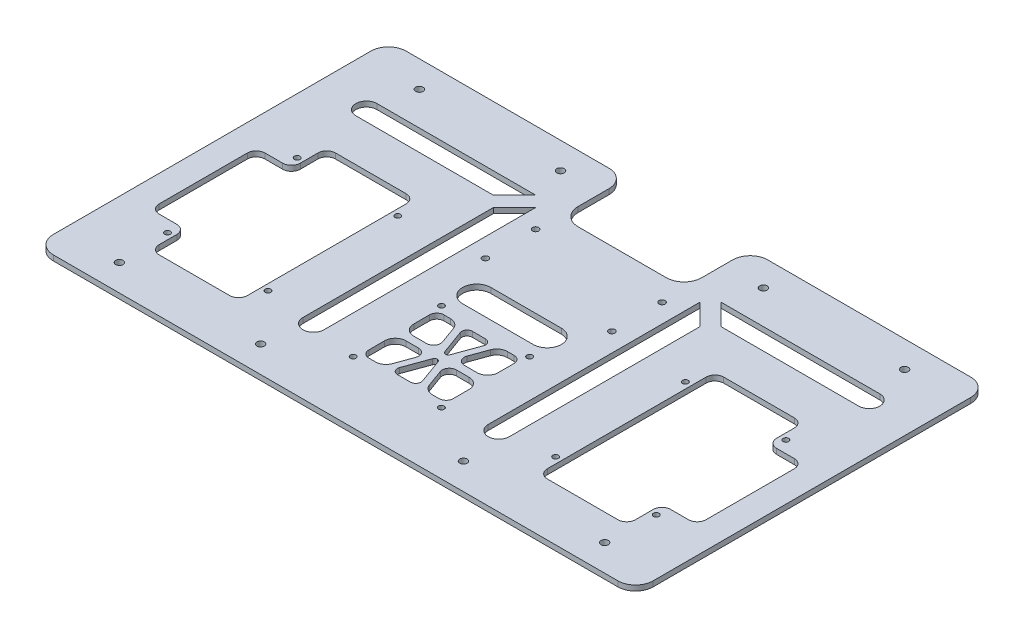
from build123d import *

# Parameters (mm, degrees)
SKETCH_1_W           = 435
SKETCH_1_H           = 200
EXTRUDE_1_DEPTH      = 3
SKETCH_2_R           = 1.6
CUT_EXTRUDE_1_DEPTH  = 157
SKETCH_3_W           = 50
SKETCH_3_H           = 100
CUT_EXTRUDE_2_DEPTH  = 157
SKETCH_5_W           = 20
SKETCH_5_H           = 60
CUT_EXTRUDE_3_DEPTH  = 157
FILLET_1_R           = 5
SKETCH_9_R           = 2.1
CUT_EXTRUDE_6_DEPTH  = 10
SKETCH_10_R          = 1.6
CUT_EXTRUDE_7_DEPTH  = 10
SKETCH_8_R           = 1.75
CUT_EXTRUDE_8_DEPTH  = 10
SKETCH_13_W          = 53.114182181
SKETCH_13_H          = 240.503799042
CUT_EXTRUDE_11_DEPTH = 10
SKETCH_14_W          = 70
SKETCH_14_H          = 75
CUT_EXTRUDE_12_DEPTH = 64.5
FILLET_4_R           = 10
CUT_EXTRUDE_13_DEPTH = 10
EXTRUDE_3_DEPTH      = 3


with BuildPart() as part:
    # 草图1 → 凸台-拉伸1 (new body)
    with BuildSketch(Plane(origin=(0, 0, 0), x_dir=(1, 0, 0), z_dir=(0, 1, 0))):
        Rectangle(SKETCH_1_W, SKETCH_1_H)
    extrude(amount=EXTRUDE_1_DEPTH)

    # 草图2 → 切除-拉伸1 (cut)
    with BuildSketch(Plane(origin=(0, 3, 0), x_dir=(1, 0, 0), z_dir=(0, 1, 0))):
        with Locations(Location((138.5, 16.75, 0), (0, 0, 270))):
            Circle(SKETCH_2_R)
        with Locations(Location((138.5, -56.75, 0), (0, 0, 270))):
            Circle(SKETCH_2_R)
        with Locations(Location((81.5, -56.75, 0), (0, 0, 270))):
            Circle(SKETCH_2_R)
        with Locations(Location((81.5, 16.75, 0), (0, 0, 270))):
            Circle(SKETCH_2_R)
        with Locations(Location((-81.5, 16.75, 0), (0, 0, 270))):
            Circle(SKETCH_2_R)
        with Locations(Location((-81.5, -56.75, 0), (0, 0, 270))):
            Circle(SKETCH_2_R)
        with Locations(Location((-138.5, -56.75, 0), (0, 0, 270))):
            Circle(SKETCH_2_R)
        with Locations(Location((-138.5, 16.75, 0), (0, 0, 270))):
            Circle(SKETCH_2_R)
    extrude(amount=-CUT_EXTRUDE_1_DEPTH, mode=Mode.SUBTRACT)

    # 草图3 → 切除-拉伸2 (cut)
    with BuildSketch(Plane(origin=(0, 3, 0), x_dir=(1, 0, 0), z_dir=(0, 1, 0))):
        with Locations((-110, -20)):
            Rectangle(SKETCH_3_W, SKETCH_3_H)
        with Locations((110, -20)):
            Rectangle(SKETCH_3_W, SKETCH_3_H)
    extrude(amount=-CUT_EXTRUDE_2_DEPTH, mode=Mode.SUBTRACT)

    # 草图5 → 切除-拉伸3 (cut)
    with BuildSketch(Plane(origin=(0, 3, 0), x_dir=(1, 0, 0), z_dir=(0, 1, 0))):
        with Locations((-145, -20)):
            Rectangle(SKETCH_5_W, SKETCH_5_H)
        with Locations((145, -20)):
            Rectangle(SKETCH_5_W, SKETCH_5_H)
    extrude(amount=-CUT_EXTRUDE_3_DEPTH, mode=Mode.SUBTRACT)

    # 圆角1
    fillet_1_edges = [part.edges().sort_by_distance(p)[0] for p in [
        (135, 1.5, -10),
        (135, 1.5, 50),
        (155, 1.5, -10),
        (155, 1.5, 50),
        (-85, 1.5, -30),
        (-85, 1.5, 70),
        (-135, 1.5, 70),
        (-135, 1.5, -30),
        (135, 1.5, -30),
        (135, 1.5, 70),
        (85, 1.5, 70),
        (85, 1.5, -30),
        (-135, 1.5, -10),
        (-135, 1.5, 50),
        (-155, 1.5, 50),
        (-155, 1.5, -10),
    ]]
    fillet(fillet_1_edges, radius=FILLET_1_R)

    # 草图9 → 切除-拉伸6 (cut)
    with BuildSketch(Plane(origin=(0, 3, 0), x_dir=(1, 0, 0), z_dir=(0, 1, 0))):
        with Locations(Location((-137.5, -85, 0), (0, 0, 270))):
            Circle(SKETCH_9_R)
        with Locations(Location((-57.5, -85, 0), (0, 0, 270))):
            Circle(SKETCH_9_R)
        with Locations(Location((57.5, -85, 0), (0, 0, 270))):
            Circle(SKETCH_9_R)
        with Locations(Location((137.5, -85, 0), (0, 0, 270))):
            Circle(SKETCH_9_R)
        with Locations(Location((137.5, 85, 0), (0, 0, 270))):
            Circle(SKETCH_9_R)
        with Locations(Location((57.5, 85, 0), (0, 0, 270))):
            Circle(SKETCH_9_R)
        with Locations(Location((-57.5, 85, 0), (0, 0, 270))):
            Circle(SKETCH_9_R)
        with Locations(Location((-137.5, 85, 0), (0, 0, 270))):
            Circle(SKETCH_9_R)
    extrude(amount=-CUT_EXTRUDE_6_DEPTH, mode=Mode.SUBTRACT)

    # 草图10 → 切除-拉伸7 (cut)
    with BuildSketch(Plane(origin=(0, 3, 0), x_dir=(1, 0, 0), z_dir=(0, 1, 0))):
        with Locations(Location((-25, -15, 0), (0, 0, 270))):
            Circle(SKETCH_10_R)
        with Locations(Location((25, -15, 0), (0, 0, 270))):
            Circle(SKETCH_10_R)
        with Locations(Location((25, -65, 0), (0, 0, 270))):
            Circle(SKETCH_10_R)
        with Locations(Location((-25, -65, 0), (0, 0, 270))):
            Circle(SKETCH_10_R)
    extrude(amount=-CUT_EXTRUDE_7_DEPTH, mode=Mode.SUBTRACT)

    # 草图8 → 切除-拉伸8 (cut)
    with BuildSketch(Plane(origin=(0, 3, 0), x_dir=(1, 0, 0), z_dir=(0, 1, 0))):
        with Locations(Location((-35.85, 49.25, 0), (0, 0, 270))):
            Circle(SKETCH_8_R)
        with Locations(Location((35.85, 49.25, 0), (0, 0, 270))):
            Circle(SKETCH_8_R)
        with Locations(Location((-35.85, 20.75, 0), (0, 0, 270))):
            Circle(SKETCH_8_R)
        with Locations(Location((35.85, 20.75, 0), (0, 0, 270))):
            Circle(SKETCH_8_R)
    extrude(amount=-CUT_EXTRUDE_8_DEPTH, mode=Mode.SUBTRACT)

    # 草图13 → 切除-拉伸11 (cut)
    with BuildSketch(Plane(origin=(0, 3, 0), x_dir=(1, 0, 0), z_dir=(0, 1, 0))):
        with BuildLine():
            Line((-46.500708687, -60), (-46.500708687, 60))
            ThreePointArc((-46.500708687, 60), (-48.258068, 64.242640687), (-52.500708687, 66))
            Line((-52.500708687, 66), (-142.500708687, 66))
            ThreePointArc((-142.500708687, 66), (-148.500708687, 60), (-142.500708687, 54))
            Line((-142.500708687, 54), (-58.500708687, 54))
            Line((-58.500708687, 54), (-58.500708687, -60))
            ThreePointArc((-58.500708687, -60), (-52.500708687, -66), (-46.500708687, -60))
        make_face()
        with BuildLine():
            ThreePointArc((52.500708687, 66), (48.258068, 64.242640687), (46.500708687, 60))
            Line((46.500708687, 60), (46.500708687, -60))
            ThreePointArc((46.500708687, -60), (52.500708687, -66), (58.500708687, -60))
            Line((58.500708687, -60), (58.500708687, 54))
            Line((58.500708687, 54), (142.500708687, 54))
            ThreePointArc((142.500708687, 54), (148.500708687, 60), (142.500708687, 66))
            Line((142.500708687, 66), (52.500708687, 66))
        make_face()
        with BuildLine():
            Line((20, 8), (-20, 8))
            ThreePointArc((-20, 8), (-28, 0), (-20, -8))
            Line((-20, -8), (20, -8))
            ThreePointArc((20, -8), (28, 0), (20, 8))
        make_face()
        with Locations((-196.557091091, 5.612879566)):
            Rectangle(SKETCH_13_W, SKETCH_13_H)
        with Locations((196.557091091, 5.612879566)):
            Rectangle(SKETCH_13_W, SKETCH_13_H)
    extrude(amount=-CUT_EXTRUDE_11_DEPTH, mode=Mode.SUBTRACT)

    # 草图14 → 切除-拉伸12 (cut)
    with BuildSketch(Plane(origin=(0, 3, 0), x_dir=(1, 0, 0), z_dir=(0, 1, 0))):
        with Locations((0, 100)):
            Rectangle(SKETCH_14_W, SKETCH_14_H)
    extrude(amount=-CUT_EXTRUDE_12_DEPTH, mode=Mode.SUBTRACT)

    # 圆角4
    fillet_4_edges = [part.edges().sort_by_distance(p)[0] for p in [
        (170, 1.5, 100),
        (-170, 1.5, 100),
        (-170, 1.5, -100),
        (170, 1.5, -100),
        (-35, 1.5, -100),
        (35, 1.5, -100),
        (35, 1.5, -62.5),
        (-35, 1.5, -62.5),
    ]]
    fillet(fillet_4_edges, radius=FILLET_4_R)

    # 草图15 → 切除-拉伸13 (cut)
    with BuildSketch(Plane(origin=(0, 3, 0), x_dir=(1, 0, 0), z_dir=(0, 1, 0))):
        with BuildLine():
            Line((-6.953821544, -32.381919427), (-10.478523956, -22.69787914))
            ThreePointArc((-10.478523956, -22.69787914), (-12.675221062, -19.835087734), (-16.11667968, -18.75))
            Line((-16.11667968, -18.75), (-19.915434451, -18.75))
            ThreePointArc((-19.915434451, -18.75), (-22.743861576, -19.921572875), (-23.915434451, -22.75))
            Line((-23.915434451, -22.75), (-23.915434451, -31.75))
            ThreePointArc((-23.915434451, -31.75), (-22.158075138, -35.992640687), (-17.915434451, -37.75))
            Line((-17.915434451, -37.75), (-10.712592027, -37.75))
            ThreePointArc((-10.712592027, -37.75), (-7.43598385, -36.044305745), (-6.953821544, -32.381919427))
        make_face()
        with BuildLine():
            Line((3.71555598, -18.75), (-3.71555598, -18.75))
            ThreePointArc((-3.71555598, -18.75), (-6.173012113, -20.029270691), (-6.534633842, -22.77606043))
            Line((-6.534633842, -22.77606043), (-1.563535714, -36.434040287))
            ThreePointArc((-1.563535714, -36.434040287), (-0.957470976, -37.29228885), (0, -37.724902295))
            ThreePointArc((0, -37.724902295), (0.957470976, -37.29228885), (1.563535714, -36.434040287))
            Line((1.563535714, -36.434040287), (6.534633842, -22.77606043))
            ThreePointArc((6.534633842, -22.77606043), (6.173012113, -20.029270691), (3.71555598, -18.75))
        make_face()
        with BuildLine():
            Line((19.915434451, -18.75), (16.11667968, -18.75))
            ThreePointArc((16.11667968, -18.75), (12.675221062, -19.835087734), (10.478523956, -22.69787914))
            Line((10.478523956, -22.69787914), (6.953821544, -32.381919427))
            ThreePointArc((6.953821544, -32.381919427), (7.43598385, -36.044305745), (10.712592027, -37.75))
            Line((10.712592027, -37.75), (17.915434451, -37.75))
            ThreePointArc((17.915434451, -37.75), (22.158075138, -35.992640687), (23.915434451, -31.75))
            Line((23.915434451, -31.75), (23.915434451, -22.75))
            ThreePointArc((23.915434451, -22.75), (22.743861576, -19.921572875), (19.915434451, -18.75))
        make_face()
        with BuildLine():
            Line((6.953821544, -47.618080573), (10.478523956, -57.30212086))
            ThreePointArc((10.478523956, -57.30212086), (12.675221062, -60.164912266), (16.11667968, -61.25))
            Line((16.11667968, -61.25), (19.915434451, -61.25))
            ThreePointArc((19.915434451, -61.25), (22.743861576, -60.078427125), (23.915434451, -57.25))
            Line((23.915434451, -57.25), (23.915434451, -48.25))
            ThreePointArc((23.915434451, -48.25), (22.158075138, -44.007359313), (17.915434451, -42.25))
            Line((17.915434451, -42.25), (10.712592027, -42.25))
            ThreePointArc((10.712592027, -42.25), (7.43598385, -43.955694255), (6.953821544, -47.618080573))
        make_face()
        with BuildLine():
            Line((-3.71555598, -61.25), (3.71555598, -61.25))
            ThreePointArc((3.71555598, -61.25), (6.173012113, -59.970729309), (6.534633842, -57.22393957))
            Line((6.534633842, -57.22393957), (1.563535714, -43.565959713))
            ThreePointArc((1.563535714, -43.565959713), (0.957470976, -42.70771115), (0, -42.275097705))
            ThreePointArc((0, -42.275097705), (-0.957470976, -42.70771115), (-1.563535714, -43.565959713))
            Line((-1.563535714, -43.565959713), (-6.534633842, -57.22393957))
            ThreePointArc((-6.534633842, -57.22393957), (-6.173012113, -59.970729309), (-3.71555598, -61.25))
        make_face()
        with BuildLine():
            Line((-10.712592027, -42.25), (-17.915434451, -42.25))
            ThreePointArc((-17.915434451, -42.25), (-22.158075138, -44.007359313), (-23.915434451, -48.25))
            Line((-23.915434451, -48.25), (-23.915434451, -57.25))
            ThreePointArc((-23.915434451, -57.25), (-22.743861576, -60.078427125), (-19.915434451, -61.25))
            Line((-19.915434451, -61.25), (-16.11667968, -61.25))
            ThreePointArc((-16.11667968, -61.25), (-12.675221062, -60.164912266), (-10.478523956, -57.30212086))
            Line((-10.478523956, -57.30212086), (-6.953821544, -47.618080573))
            ThreePointArc((-6.953821544, -47.618080573), (-7.43598385, -43.955694255), (-10.712592027, -42.25))
        make_face()
    extrude(amount=-CUT_EXTRUDE_13_DEPTH, mode=Mode.SUBTRACT)

    # 草图16 → 凸台-拉伸3 (add)
    with BuildSketch(Plane(origin=(0, 3, 0), x_dir=(1, 0, 0), z_dir=(0, 1, 0))):
        with BuildLine():
            Line((-46.500708687, 60), (-58.500708687, 48))
            Line((-58.500708687, 48), (-58.500708687, 54))
            Line((-58.500708687, 54), (-64.500708687, 54))
            Line((-64.500708687, 54), (-52.500708687, 66))
            ThreePointArc((-52.500708687, 66), (-48.258068, 64.242640687), (-46.500708687, 60))
        make_face()
        with BuildLine():
            ThreePointArc((46.500708687, 60), (48.258068, 64.242640687), (52.500708687, 66))
            Line((52.500708687, 66), (64.500708687, 54))
            Line((64.500708687, 54), (58.500708687, 54))
            Line((58.500708687, 54), (58.500708687, 48))
            Line((58.500708687, 48), (46.500708687, 60))
        make_face()
    extrude(amount=-EXTRUDE_3_DEPTH)


solid = part.part
